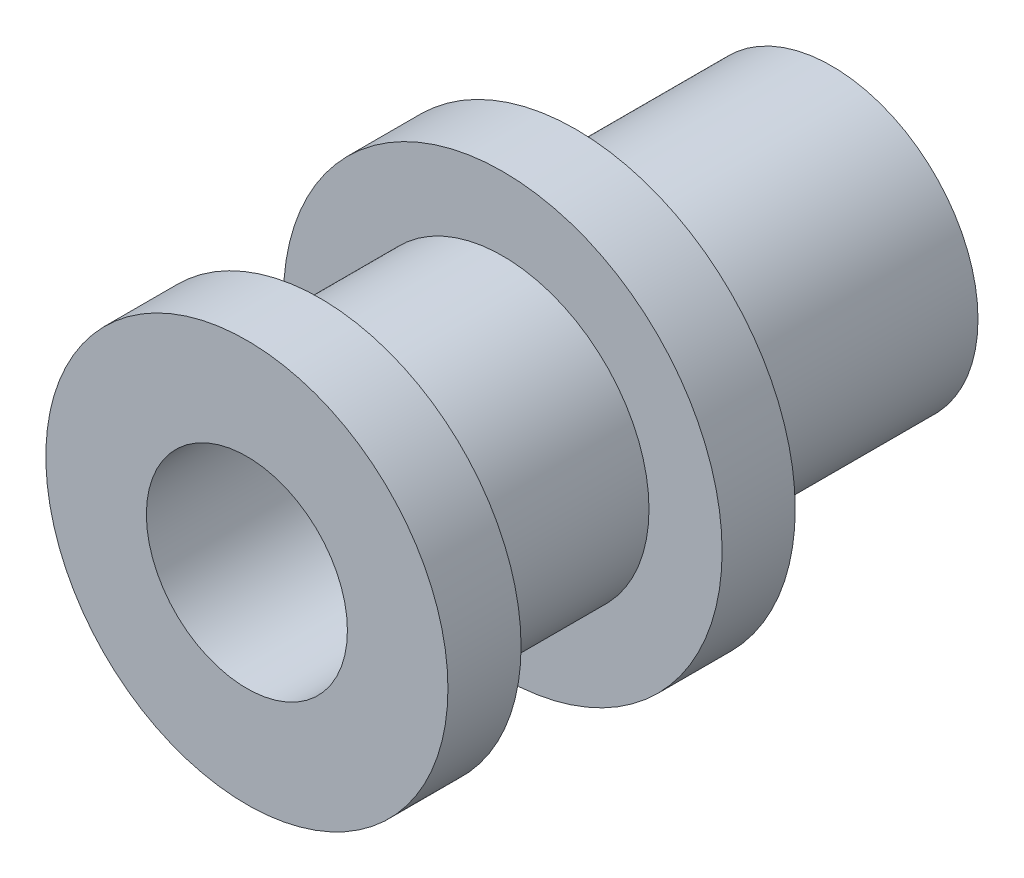
from build123d import *

# Parameters (mm, degrees)
SKETCH1_R    = 5.5
FLANGE_DEPTH = 2
BARREL_START = -14
SKETCH2_R    = 4
BARREL_DEPTH = 14
NUT_START    = -7
SKETCH3_R    = 6
NUT_DEPTH    = 2
SOCKET_START = 2
SKETCH4_R    = 2.75
SOCKET_DEPTH = 10


with BuildPart() as part:
    # Sketch1 → Flange (new body)
    with BuildSketch(Plane.XY):
        Circle(SKETCH1_R)
    extrude(amount=FLANGE_DEPTH)

    # Sketch2 → Barrel (add)
    with BuildSketch(Plane.XY.offset(BARREL_START)):
        Circle(SKETCH2_R)
    extrude(amount=BARREL_DEPTH)

    # Sketch3 → Nut (add)
    with BuildSketch(Plane.XY.offset(NUT_START)):
        Circle(SKETCH3_R)
    extrude(amount=NUT_DEPTH)

    # Sketch4 → Socket (cut)
    with BuildSketch(Plane.XY.offset(SOCKET_START)):
        Circle(SKETCH4_R)
    extrude(amount=-SOCKET_DEPTH, mode=Mode.SUBTRACT)


solid = part.part
